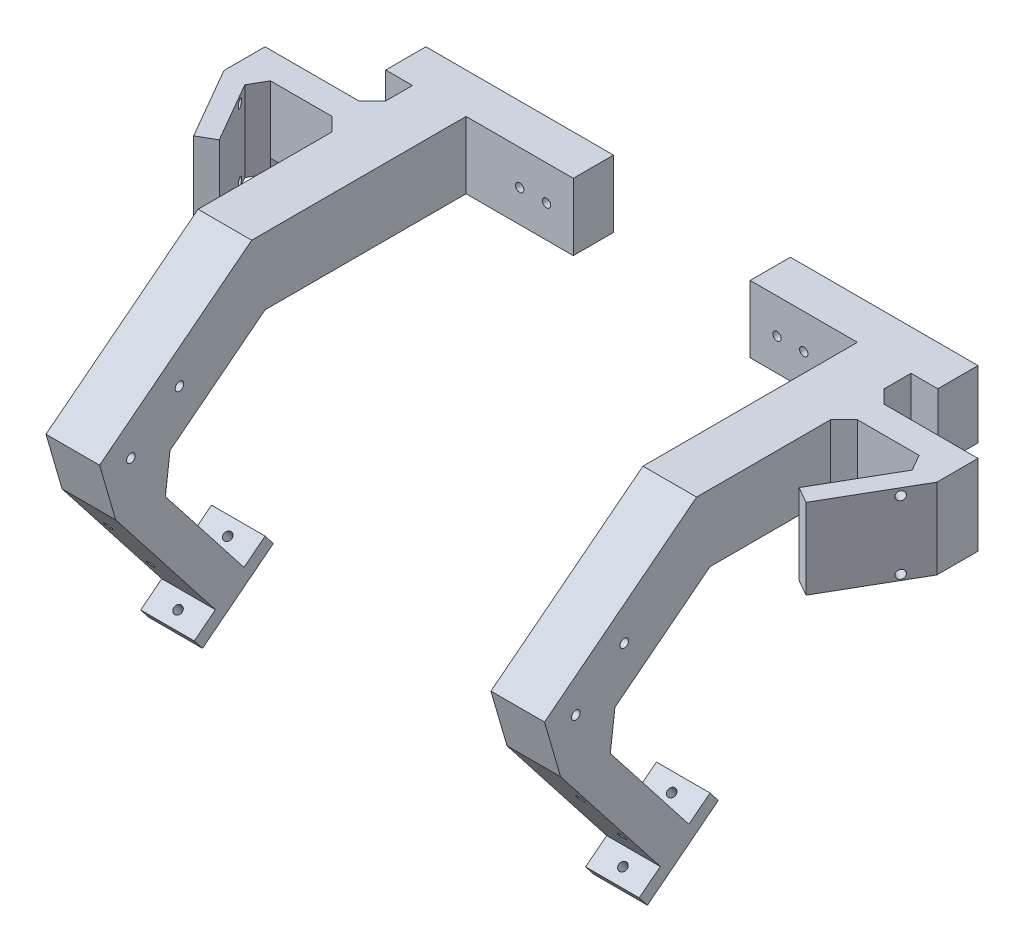
from build123d import *

# Parameters (mm, degrees)
SKETCH_1_W                       = 206
SKETCH_1_H                       = 25
EXTRUDE_1_DEPTH                  = 15
EXTRUDE_2_DEPTH                  = 30
EXTRUDE_3_DEPTH                  = 30
CUT_EXTRUDE_1_DEPTH              = 10
CUT_EXTRUDE_2_DEPTH              = 10
SKETCH_12_R                      = 1.55
CUT_EXTRUDE_6_DEPTH              = 183.26098149
EXTRUDE_5_DEPTH                  = 20
EXTRUDE_6_DEPTH                  = 20
EXTRUDE_7_DEPTH                  = 20
EXTRUDE_8_DEPTH                  = 20
SKETCH_17_R                      = 1.55
CUT_EXTRUDE_7_DEPTH              = 20
SKETCH_20_R                      = 1.55
CUT_EXTRUDE_8_DEPTH              = 20
SKETCH_21_R                      = 1.55
CUT_EXTRUDE_9_DEPTH              = 20
SKETCH_22_R                      = 1.6
CUT_EXTRUDE_10_DEPTH             = 261.959247659
SKETCH_23_R                      = 1.6
CUT_EXTRUDE_11_DEPTH             = 261.959247659
CUT_EXTRUDE_12_REACH             = 188.247
SKETCH_24_R                      = 1.55
CUT_EXTRUDE_13_REACH             = 188.247
SKETCH_25_R                      = 1.55
EXTRUDE_9_DEPTH                  = 25
EXTRUDE_10_DEPTH                 = 25
EXTRUDE_11_DEPTH                 = 25
EXTRUDE_13_DEPTH                 = 5
CUT_EXTRUDE_14_REACH             = 291.457
SKETCH_31_R                      = 1.6
CUT_EXTRUDE_14_DIRECTION_2_DEPTH = 290.457009885
CUT_EXTRUDE_15_REACH             = 291.457
SKETCH_33_R                      = 1.6
EXTRUDE_14_DEPTH                 = 25
EXTRUDE_15_DEPTH                 = 20
EXTRUDE_16_DEPTH                 = 20
CUT_EXTRUDE_16_DEPTH             = 297.984391742
SKETCH_38_W                      = 66
SKETCH_38_H                      = 25
CUT_EXTRUDE_17_DEPTH             = 221.301522584


with BuildPart() as part:
    # 草图1 → 凸台-拉伸1 (new body)
    with BuildSketch(Plane.XY):
        Rectangle(SKETCH_1_W, SKETCH_1_H)
    extrude(amount=EXTRUDE_1_DEPTH)

    # 草图3 → 凸台-拉伸2 (add)
    with BuildSketch(Plane(origin=(103, 0, 0), x_dir=(0, 0, -1), z_dir=(1, 0, 0))):
        Polygon((-90, -12.5), (-133.340591448, -46.361381143), (-158.040860289, -36.752918026), (-95, 12.5), (-15, 12.5), (-15, -12.5), align=None)
    extrude(amount=-EXTRUDE_2_DEPTH)

    # 草图4 → 凸台-拉伸3 (add)
    with BuildSketch(Plane.ZY.offset(103)):
        Polygon((90, -12.5), (133.340591448, -46.361381143), (158.040860289, -36.752918026), (95, 12.5), (15, 12.5), (15, -12.5), align=None)
    extrude(amount=-EXTRUDE_3_DEPTH)

    # 草图3<2> → 切除-拉伸1 (cut)
    with BuildSketch(Plane(origin=(103, 0, 0), x_dir=(0, 0, -1), z_dir=(1, 0, 0))):
        Polygon((-90, -12.5), (-133.340591448, -46.361381143), (-158.040860289, -36.752918026), (-95, 12.5), (-15, 12.5), (-15, -12.5), align=None)
    extrude(amount=-CUT_EXTRUDE_1_DEPTH, mode=Mode.SUBTRACT)

    # 草图4<2> → 切除-拉伸2 (cut)
    with BuildSketch(Plane.ZY.offset(103)):
        Polygon((15, 12.5), (15, -12.5), (90, -12.5), (133.340591448, -46.361381143), (158.040860289, -36.752918026), (95, 12.5), align=None)
    extrude(amount=-CUT_EXTRUDE_2_DEPTH, mode=Mode.SUBTRACT)

    # 草图12 → 切除-拉伸6 (cut, through all)
    with BuildSketch(Plane.XY.offset(15)):
        with Locations((-53, -0.5)):
            Circle(SKETCH_12_R)
        with Locations((-43, -0.5)):
            Circle(SKETCH_12_R)
    extrude(amount=-CUT_EXTRUDE_6_DEPTH, mode=Mode.SUBTRACT)

    # 草图13 → 凸台-拉伸5 (add)
    with BuildSketch(Plane.ZY.offset(93)):
        Polygon((133.340591448, -46.361381143), (94.781570561, -95.714677274), (105.457947561, -104.055977167), (158.040860289, -36.752918026), align=None)
    extrude(amount=-EXTRUDE_5_DEPTH)

    # 草图14 → 凸台-拉伸6 (add)
    with BuildSketch(Plane(origin=(93, 0, 0), x_dir=(0, 0, -1), z_dir=(1, 0, 0))):
        Polygon((-94.781570561, -95.714677274), (-133.340591448, -46.361381143), (-158.040860289, -36.752918026), (-105.457947561, -104.055977167), align=None)
    extrude(amount=-EXTRUDE_6_DEPTH)

    # 草图15 → 凸台-拉伸7 (add)
    with BuildSketch(Plane.ZY.offset(93)):
        Polygon((97.859877937, -91.774623506), (89.979770401, -85.618008752), (86.901463025, -89.55806252), (94.781570561, -95.714677274), align=None)
        Polygon((108.536254938, -100.115923399), (116.416362474, -106.272538153), (113.338055097, -110.212591921), (105.457947561, -104.055977167), align=None)
    extrude(amount=-EXTRUDE_7_DEPTH)

    # 草图16 → 凸台-拉伸8 (add)
    with BuildSketch(Plane(origin=(93, 0, 0), x_dir=(0, 0, -1), z_dir=(1, 0, 0))):
        Polygon((-108.536254938, -100.115923399), (-116.416362474, -106.272538153), (-113.338055097, -110.212591921), (-105.457947561, -104.055977167), align=None)
        Polygon((-89.979770401, -85.618008752), (-97.859877937, -91.774623506), (-94.781570561, -95.714677274), (-86.901463025, -89.55806252), align=None)
    extrude(amount=-EXTRUDE_8_DEPTH)

    # 草图17 → 切除-拉伸7 (cut)
    with BuildSketch(Plane(origin=(0, -9.511946528, -7.431547102), x_dir=(1, 0, 0), z_dir=(0, 0.7880107536067189, 0.6156614753256623))):
        with Locations(Location((-83, -152.165253151, 0), (0, 0, 270))):
            Circle(SKETCH_17_R)
        with Locations(Location((-83, -128.616736266, 0), (0, 0, 270))):
            Circle(SKETCH_17_R)
    extrude(amount=-CUT_EXTRUDE_7_DEPTH, mode=Mode.SUBTRACT)

    # 草图20 → 切除-拉伸8 (cut)
    with BuildSketch(Plane(origin=(0, -9.511946528, -7.431547102), x_dir=(1, 0, 0), z_dir=(0, 0.7880107536067189, 0.6156614753256623))):
        with Locations(Location((83, -152.165253151, 0), (0, 0, 270))):
            Circle(SKETCH_20_R)
        with Locations(Location((82.647963781, -128.616736266, 0), (0, 0, 270))):
            Circle(SKETCH_20_R)
    extrude(amount=-CUT_EXTRUDE_8_DEPTH, mode=Mode.SUBTRACT)

    # 草图21 → 切除-拉伸9 (cut)
    with BuildSketch(Plane(origin=(0, 0, 0), x_dir=(-1, 0, 0), z_dir=(0, 0, -1))):
        with Locations((-43, -0.5)):
            Circle(SKETCH_21_R)
        with Locations((-53, -0.5)):
            Circle(SKETCH_21_R)
    extrude(amount=-CUT_EXTRUDE_9_DEPTH, mode=Mode.SUBTRACT)

    # 草图22 → 切除-拉伸10 (cut, through all)
    with BuildSketch(Plane.ZY.offset(-73)):
        with Locations((140.064084231, -35.398103432)):
            Circle(SKETCH_22_R)
        with Locations((121.939836898, -21.2378895)):
            Circle(SKETCH_22_R)
    extrude(amount=-CUT_EXTRUDE_10_DEPTH, mode=Mode.SUBTRACT)

    # 草图23 → 切除-拉伸11 (cut, through all)
    with BuildSketch(Plane(origin=(-73, 0, 0), x_dir=(0, 0, -1), z_dir=(1, 0, 0))):
        with Locations(Location((-121.939836898, -21.2378895, 0), (0, 0, 180))):
            Circle(SKETCH_23_R)
        with Locations(Location((-140.064084231, -35.398103432, 0), (0, 0, 180))):
            Circle(SKETCH_23_R)
    extrude(amount=-CUT_EXTRUDE_11_DEPTH, mode=Mode.SUBTRACT)

    # 草图24 → 切除-拉伸12 (cut, up to next)
    with BuildSketch(Plane(origin=(0, -90.603976872, 115.96780204), x_dir=(1, 0, 0), z_dir=(0, -0.615661475325662, 0.7880107536067192)), mode=Mode.PRIVATE) as cut_extrude_12_sk1:
        with Locations(Location((88, 28.329166595, 0), (0, 0, 270))):
            Circle(SKETCH_24_R)
    cut_extrude_12_tool1 = extrude(cut_extrude_12_sk1.sketch, amount=-CUT_EXTRUDE_12_REACH, mode=Mode.PRIVATE) & part.part
    # 草图24 → 切除-拉伸12 (cut, up to next)
    with BuildSketch(Plane(origin=(0, -90.603976872, 115.96780204), x_dir=(1, 0, 0), z_dir=(0, -0.615661475325662, 0.7880107536067192)), mode=Mode.PRIVATE) as cut_extrude_12_sk2:
        with Locations(Location((88, 2.929166595, 0), (0, 0, 270))):
            Circle(SKETCH_24_R)
    cut_extrude_12_tool2 = extrude(cut_extrude_12_sk2.sketch, amount=-CUT_EXTRUDE_12_REACH, mode=Mode.PRIVATE) & part.part
    add(cut_extrude_12_tool1.solids().sort_by_distance((88, -68.280289, 133.408979))[0], mode=Mode.SUBTRACT)
    add(cut_extrude_12_tool2.solids().sort_by_distance((88, -88.295762, 117.771177))[0], mode=Mode.SUBTRACT)

    # 草图25 → 切除-拉伸13 (cut, up to next)
    with BuildSketch(Plane(origin=(0, -90.603976872, 115.96780204), x_dir=(1, 0, 0), z_dir=(0, -0.6156614753256618, 0.7880107536067191)), mode=Mode.PRIVATE) as cut_extrude_13_sk1:
        with Locations(Location((-88, 28.329166595, 0), (0, 0, 270))):
            Circle(SKETCH_25_R)
    cut_extrude_13_tool1 = extrude(cut_extrude_13_sk1.sketch, amount=-CUT_EXTRUDE_13_REACH, mode=Mode.PRIVATE) & part.part
    # 草图25 → 切除-拉伸13 (cut, up to next)
    with BuildSketch(Plane(origin=(0, -90.603976872, 115.96780204), x_dir=(1, 0, 0), z_dir=(0, -0.6156614753256618, 0.7880107536067191)), mode=Mode.PRIVATE) as cut_extrude_13_sk2:
        with Locations(Location((-88, 2.929166595, 0), (0, 0, 270))):
            Circle(SKETCH_25_R)
    cut_extrude_13_tool2 = extrude(cut_extrude_13_sk2.sketch, amount=-CUT_EXTRUDE_13_REACH, mode=Mode.PRIVATE) & part.part
    add(cut_extrude_13_tool1.solids().sort_by_distance((-88, -68.280289, 133.408979))[0], mode=Mode.SUBTRACT)
    add(cut_extrude_13_tool2.solids().sort_by_distance((-88, -88.295762, 117.771177))[0], mode=Mode.SUBTRACT)

    # 草图26 → 凸台-拉伸9 (add)
    with BuildSketch(Plane(origin=(0, 12.5, 0), x_dir=(1, 0, 0), z_dir=(0, 1, 0))):
        Polygon((-93, -30), (-93, -40), (-128, -40), (-111.47796301, -68.617007511), (-117.540140837, -72.117007511), (-133, -45.339745962), (-133, -30), align=None)
    extrude(amount=-EXTRUDE_9_DEPTH)

    # 草图27 → 凸台-拉伸10 (add)
    with BuildSketch(Plane.XZ.offset(12.5)):
        Polygon((93, 30), (133, 30), (133, 45.339745962), (115.124000593, 76.301885171), (109.061822767, 72.801885171), (128, 40), (93, 40), align=None)
    extrude(amount=-EXTRUDE_10_DEPTH)

    # 草图28 → 凸台-拉伸11 (add)
    with BuildSketch(Plane(origin=(0, 12.5, 0), x_dir=(1, 0, 0), z_dir=(0, 1, 0))):
        Polygon((-124.5, -46.062177826), (-121, -40), (-128, -40), align=None)
        Polygon((121, -40), (128, -40), (124.5, -46.062177826), align=None)
    extrude(amount=-EXTRUDE_11_DEPTH)

    # 草图30 → 凸台-拉伸13 (add)
    with BuildSketch(Plane.XZ.offset(12.5)):
        Polygon((-124.5, 46.062177826), (-111.47796301, 68.617007511), (-117.540140837, 72.117007511), (-133, 45.339745962), (-133, 30), (-121, 30), (-121, 40), align=None)
        Polygon((133, 45.339745962), (115.124000593, 76.301885171), (109.061822767, 72.801885171), (124.5, 46.062177826), (121, 40), (121, 30), (133, 30), align=None)
    extrude(amount=EXTRUDE_13_DEPTH)

    # 草图31 → 切除-拉伸14 (cut, up to next)
    with BuildSketch(Plane(origin=(119.382685902, 0, 68.925625842), x_dir=(0.5000000000000046, 0, -0.8660254037844359), z_dir=(0.866025403784436, 0, 0.5000000000000047)), mode=Mode.PRIVATE) as cut_extrude_14_sk1:
        with Locations(Location((17.358983849, 9.9, 0), (0, 0, 180))):
            Circle(SKETCH_31_R)
    cut_extrude_14_tool1 = extrude(cut_extrude_14_sk1.sketch, amount=-CUT_EXTRUDE_14_REACH, mode=Mode.PRIVATE) & part.part
    # 草图31 → 切除-拉伸14 (cut, up to next)
    with BuildSketch(Plane(origin=(119.382685902, 0, 68.925625842), x_dir=(0.5000000000000046, 0, -0.8660254037844359), z_dir=(0.866025403784436, 0, 0.5000000000000047)), mode=Mode.PRIVATE) as cut_extrude_14_sk2:
        with Locations(Location((17.358983849, -15.5, 0), (0, 0, 180))):
            Circle(SKETCH_31_R)
    cut_extrude_14_tool2 = extrude(cut_extrude_14_sk2.sketch, amount=-CUT_EXTRUDE_14_REACH, mode=Mode.PRIVATE) & part.part
    add(cut_extrude_14_tool1.solids().sort_by_distance((128.062178, 9.9, 53.892305))[0], mode=Mode.SUBTRACT)
    add(cut_extrude_14_tool2.solids().sort_by_distance((128.062178, -15.5, 53.892305))[0], mode=Mode.SUBTRACT)

    # 草图31 → 切除-拉伸14 direction 2 (cut)
    with BuildSketch(Plane(origin=(119.382685902, 0, 68.925625842), x_dir=(0.5000000000000046, 0, -0.8660254037844359), z_dir=(0.866025403784436, 0, 0.5000000000000047))):
        with Locations(Location((17.358983849, 9.9, 0), (0, 0, 180))):
            Circle(SKETCH_31_R)
        with Locations(Location((17.358983849, -15.5, 0), (0, 0, 180))):
            Circle(SKETCH_31_R)
    extrude(amount=CUT_EXTRUDE_14_DIRECTION_2_DEPTH, mode=Mode.SUBTRACT)

    # 草图33 → 切除-拉伸15 (cut, up to next)
    with BuildSketch(Plane(origin=(-119.382685902, 0, 68.925625842), x_dir=(0.5000000000000044, 0, 0.866025403784436), z_dir=(-0.8660254037844362, 0, 0.5000000000000046)), mode=Mode.PRIVATE) as cut_extrude_15_sk1:
        with Locations((-17.358983849, 9.9)):
            Circle(SKETCH_33_R)
    cut_extrude_15_tool1 = extrude(cut_extrude_15_sk1.sketch, amount=-CUT_EXTRUDE_15_REACH, mode=Mode.PRIVATE) & part.part
    # 草图33 → 切除-拉伸15 (cut, up to next)
    with BuildSketch(Plane(origin=(-119.382685902, 0, 68.925625842), x_dir=(0.5000000000000044, 0, 0.866025403784436), z_dir=(-0.8660254037844362, 0, 0.5000000000000046)), mode=Mode.PRIVATE) as cut_extrude_15_sk2:
        with Locations((-17.358983849, -15.5)):
            Circle(SKETCH_33_R)
    cut_extrude_15_tool2 = extrude(cut_extrude_15_sk2.sketch, amount=-CUT_EXTRUDE_15_REACH, mode=Mode.PRIVATE) & part.part
    add(cut_extrude_15_tool1.solids().sort_by_distance((-128.062178, 9.9, 53.892305))[0], mode=Mode.SUBTRACT)
    add(cut_extrude_15_tool2.solids().sort_by_distance((-128.062178, -15.5, 53.892305))[0], mode=Mode.SUBTRACT)

    # 草图34 → 凸台-拉伸14 (add)
    with BuildSketch(Plane(origin=(0, 12.5, 0), x_dir=(1, 0, 0), z_dir=(0, 1, 0))):
        Polygon((-98, -40), (-93, -45), (-93, -40), align=None)
        Polygon((-98, -30), (-93, -25), (-93, -30), align=None)
        Polygon((93, -25), (93, -30), (98, -30), align=None)
        Polygon((93, -45), (93, -40), (98, -40), align=None)
    extrude(amount=-EXTRUDE_14_DEPTH)

    # 草图35 → 凸台-拉伸15 (add)
    with BuildSketch(Plane.ZY.offset(93)):
        Polygon((125.460483912, -40.20476639), (133.340591448, -46.361381143), (127.183976695, -54.241488679), align=None)
    extrude(amount=-EXTRUDE_15_DEPTH)

    # 草图36 → 凸台-拉伸16 (add)
    with BuildSketch(Plane(origin=(93, 0, 0), x_dir=(0, 0, -1), z_dir=(1, 0, 0))):
        Polygon((-125.460483912, -40.20476639), (-133.340591448, -46.361381143), (-127.183976695, -54.241488679), align=None)
    extrude(amount=-EXTRUDE_16_DEPTH)

    # 草图37 → 切除-拉伸16 (cut, through all)
    with BuildSketch(Plane.ZY.offset(93)):
        Polygon((145.727630782, -52.513133098), (151.73677426, -31.827626223), (158.040860289, -36.752918026), align=None)
    extrude(amount=-CUT_EXTRUDE_16_DEPTH, mode=Mode.SUBTRACT)

    # 草图38 → 切除-拉伸17 (cut, through all)
    with BuildSketch(Plane.XY.offset(15)):
        Rectangle(SKETCH_38_W, SKETCH_38_H)
    extrude(amount=-CUT_EXTRUDE_17_DEPTH, mode=Mode.SUBTRACT)


with BuildPart() as cut_extrude_17_piece_1:
    # of the separate pieces the step leaves, piece 1, a body of its own (cut_extrude_17_pieces)
    add(part.part.solids().sort_by_distance((33, 12.5, 0))[0])


with BuildPart() as cut_extrude_17_piece_2:
    # of the separate pieces the step leaves, piece 2, a body of its own (cut_extrude_17_pieces)
    add(part.part.solids().sort_by_distance((-103, 12.5, 0))[0])


solid = Compound([cut_extrude_17_piece_1.part, cut_extrude_17_piece_2.part])
